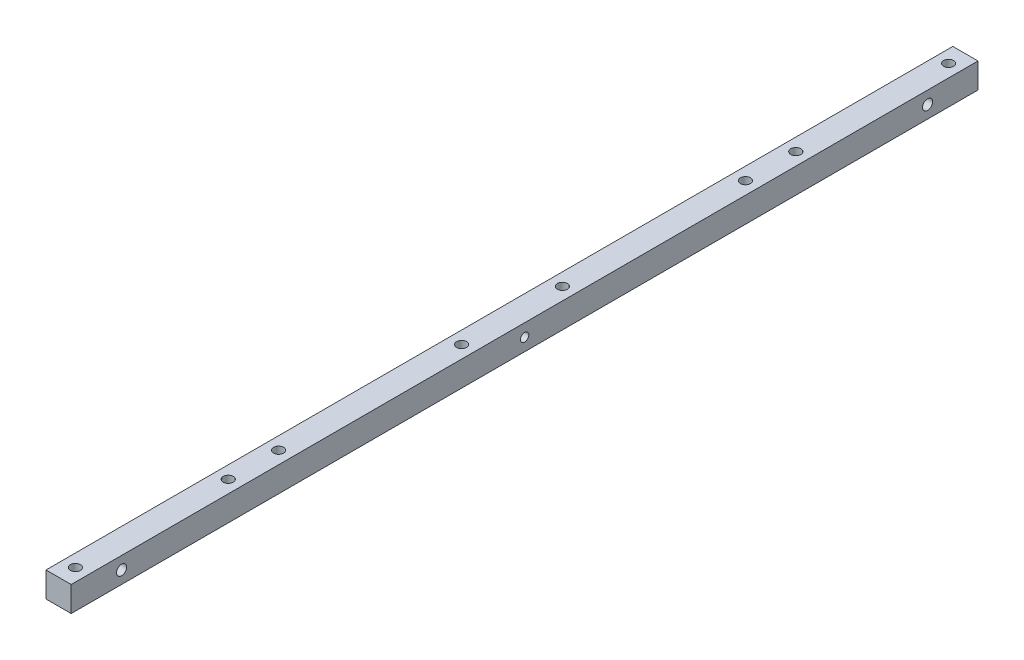
from build123d import *

# Parameters (mm, degrees)
ESQUISSE1_W             = 7.5
ESQUISSE1_H             = 7.5
BOSS_EXTRU_1_DEPTH      = 135
ESQUISSE2_R             = 1.5
ESQUISSE2_R_2           = 1.25
ENL_V_MAT_EXTRU_1_DEPTH = 136.260165977
ESQUISSE3_R             = 1.5
ENL_V_MAT_EXTRU_2_DEPTH = 136.260165977


with BuildPart() as part:
    # Esquisse1 → Boss.-Extru.1 (new, symmetric)
    with BuildSketch(Plane.XY):
        Rectangle(ESQUISSE1_W, ESQUISSE1_H)
    extrude(amount=BOSS_EXTRU_1_DEPTH, both=True)

    # Esquisse2 → Enlèv. mat.-Extru.1 (cut, through all)
    with BuildSketch(Plane(origin=(3.75, 0, 0), x_dir=(0, 0, -1), z_dir=(1, 0, 0))):
        with Locations((-120, 0)):
            Circle(ESQUISSE2_R)
        with Locations((120, 0)):
            Circle(ESQUISSE2_R)
        Circle(ESQUISSE2_R_2)
    extrude(amount=-ENL_V_MAT_EXTRU_1_DEPTH, mode=Mode.SUBTRACT)

    # Esquisse3 → Enlèv. mat.-Extru.2 (cut, through all)
    with BuildSketch(Plane(origin=(0, 3.75, 0), x_dir=(1, 0, 0), z_dir=(0, 1, 0))):
        with Locations(Location((0, -69.5, 0), (0, 0, 270))):
            Circle(ESQUISSE3_R)
        with Locations(Location((0, -84.5, 0), (0, 0, 270))):
            Circle(ESQUISSE3_R)
        with Locations(Location((0, 84.5, 0), (0, 0, 90))):
            Circle(ESQUISSE3_R)
        with Locations(Location((0, 69.5, 0), (0, 0, 90))):
            Circle(ESQUISSE3_R)
        with Locations(Location((0, -130, 0), (0, 0, 270))):
            Circle(ESQUISSE3_R)
        with Locations(Location((0, 130, 0), (0, 0, 90))):
            Circle(ESQUISSE3_R)
        with Locations(Location((0, -15, 0), (0, 0, 270))):
            Circle(ESQUISSE3_R)
        with Locations(Location((0, 15, 0), (0, 0, 90))):
            Circle(ESQUISSE3_R)
    extrude(amount=-ENL_V_MAT_EXTRU_2_DEPTH, mode=Mode.SUBTRACT)


solid = part.part
